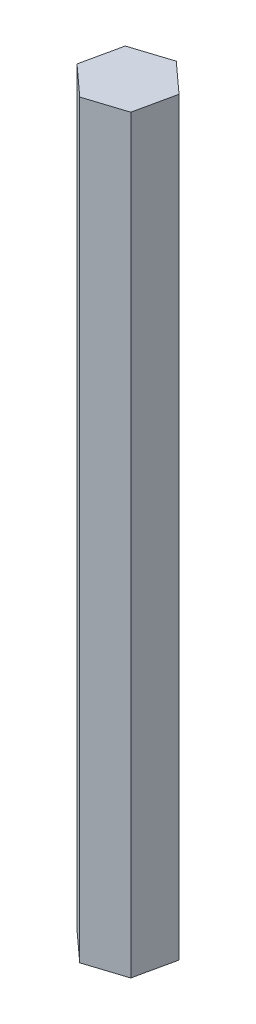
from build123d import *

# Parameters (mm, degrees)
BOSS_EXTRUDE1_DEPTH = 53.34


with BuildPart() as part:
    # Sketch2 → Boss-Extrude1 (new body)
    with BuildSketch(Plane(origin=(0, 0, 0), x_dir=(1, 0, 0), z_dir=(0, 1, 0))):
        Polygon((2.137295047, -1.940438924), (2.749116926, 0.880732344), (0.611821879, 2.821171268), (-2.137295047, 1.940438924), (-2.749116926, -0.880732344), (-0.611821879, -2.821171268), align=None)
    extrude(amount=BOSS_EXTRUDE1_DEPTH)


solid = part.part
